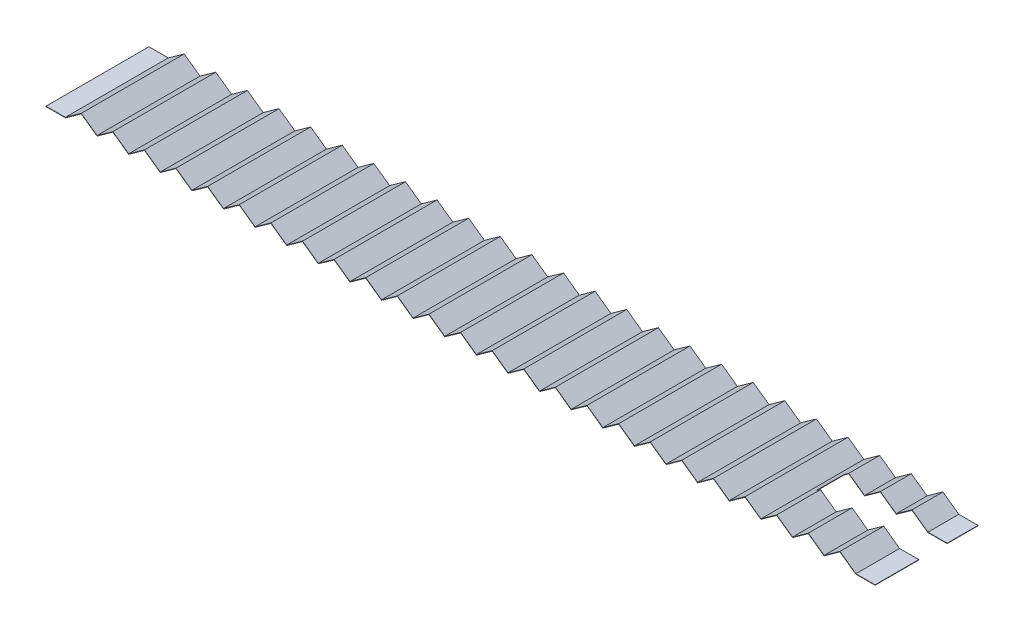
from build123d import *

# Parameters (mm, degrees)
EXTRUDE_THIN1_DEPTH     = 40
CUT_EXTRUDE4_DEPTH      = 631.486696668
CUT_EXTRUDE4_DEPTH_BACK = 631.486696668
SKETCH2_W               = 80
SKETCH2_H               = 22


with BuildPart() as part:
    # Sketch1 → Extrude-Thin1 (new, symmetric)
    with BuildSketch(Plane.XY):
        Polygon((-15.1, 0), (0, 0), (12.283, 8.78281908), (24.566, 0), (36.849, 8.78281908), (49.132, 0), (61.415, 8.78281908), (73.698, 0), (85.981, 8.78281908), (98.264, 0), (110.547, 8.78281908), (122.83, 0), (135.113, 8.78281908), (147.396, 0), (159.679, 8.78281908), (171.962, 0), (184.245, 8.78281908), (196.528, 0), (208.811, 8.78281908), (221.094, 0), (233.377, 8.78281908), (245.66, 0), (257.943, 8.78281908), (270.226, 0), (282.509, 8.78281908), (294.792, 0), (307.075, 8.78281908), (319.358, 0), (331.641, 8.78281908), (343.924, 0), (356.207, 8.78281908), (368.49, 0), (380.773, 8.78281908), (393.056, 0), (405.339, 8.78281908), (417.622, 0), (429.905, 8.78281908), (442.188, 0), (454.471, 8.78281908), (466.754, 0), (479.037, 8.78281908), (491.32, 0), (503.603, 8.78281908), (515.886, 0), (528.169, 8.78281908), (540.452, 0), (552.735, 8.78281908), (565.018, 0), (577.301, 8.78281908), (589.584, 0), (601.867, 8.78281908), (614.15, 0), (629.15, 0), (629.15, 0.3), (614.246221952, 0.3), (601.867, 9.15162149), (589.584, 0.36880241), (577.301, 9.15162149), (565.018, 0.36880241), (552.735, 9.15162149), (540.452, 0.36880241), (528.169, 9.15162149), (515.886, 0.36880241), (503.603, 9.15162149), (491.32, 0.36880241), (479.037, 9.15162149), (466.754, 0.36880241), (454.471, 9.15162149), (442.188, 0.36880241), (429.905, 9.15162149), (417.622, 0.36880241), (405.339, 9.15162149), (393.056, 0.36880241), (380.773, 9.15162149), (368.49, 0.36880241), (356.207, 9.15162149), (343.924, 0.36880241), (331.641, 9.15162149), (319.358, 0.36880241), (307.075, 9.15162149), (294.792, 0.36880241), (282.509, 9.15162149), (270.226, 0.36880241), (257.943, 9.15162149), (245.66, 0.36880241), (233.377, 9.15162149), (221.094, 0.36880241), (208.811, 9.15162149), (196.528, 0.36880241), (184.245, 9.15162149), (171.962, 0.36880241), (159.679, 9.15162149), (147.396, 0.36880241), (135.113, 9.15162149), (122.83, 0.36880241), (110.547, 9.15162149), (98.264, 0.36880241), (85.981, 9.15162149), (73.698, 0.36880241), (61.415, 9.15162149), (49.132, 0.36880241), (36.849, 9.15162149), (24.566, 0.36880241), (12.283, 9.15162149), (-0.096221952, 0.3), (-15.1, 0.3), align=None)
    extrude(amount=EXTRUDE_THIN1_DEPTH, both=True)

    # Sketch2 → Cut-Extrude4 (cut, two sides: drawn at the far end of the back side and taken through both)
    with BuildSketch(Plane(origin=(0, 0, 0), x_dir=(1, 0, 0), z_dir=(0, 1, 0)).offset(-CUT_EXTRUDE4_DEPTH_BACK)):
        with Locations((589.15, 5)):
            Rectangle(SKETCH2_W, SKETCH2_H)
    extrude(amount=CUT_EXTRUDE4_DEPTH + CUT_EXTRUDE4_DEPTH_BACK, mode=Mode.SUBTRACT)


solid = part.part
